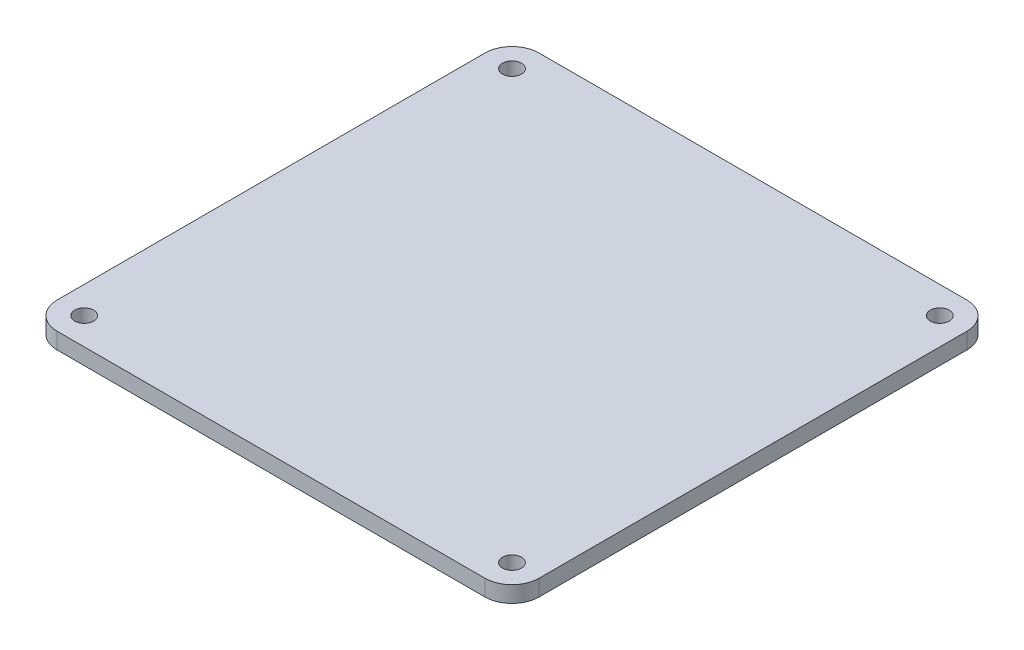
from build123d import *

# Parameters (mm, degrees)
SKETCH1_R           = 1.75
BOSS_EXTRUDE1_DEPTH = 3


with BuildPart() as part:
    # Sketch1 → Boss-Extrude1 (new body)
    with BuildSketch(Plane(origin=(0, 0, 0), x_dir=(1, 0, 0), z_dir=(0, 1, 0))):
        with BuildLine():
            ThreePointArc((-44.494041124, 39.494041124), (-43.02957503, 43.02957503), (-39.494041124, 44.494041124))
            Line((-39.494041124, 44.494041124), (0, 44.494041124))
            Line((0, 44.494041124), (39.494041124, 44.494041124))
            ThreePointArc((39.494041124, 44.494041124), (43.02957503, 43.02957503), (44.494041124, 39.494041124))
            Line((44.494041124, 39.494041124), (44.494041124, 0))
            Line((44.494041124, 0), (44.494041124, -39.494041124))
            ThreePointArc((44.494041124, -39.494041124), (43.02957503, -43.02957503), (39.494041124, -44.494041124))
            Line((39.494041124, -44.494041124), (0, -44.494041124))
            Line((0, -44.494041124), (-39.494041124, -44.494041124))
            ThreePointArc((-39.494041124, -44.494041124), (-43.02957503, -43.02957503), (-44.494041124, -39.494041124))
            Line((-44.494041124, -39.494041124), (-44.494041124, 0))
            Line((-44.494041124, 0), (-44.494041124, 39.494041124))
        make_face()
        with Locations(Location((-39.494041124, -39.494041124, 0), (0, 0, 270))):
            Circle(SKETCH1_R, mode=Mode.SUBTRACT)
        with Locations(Location((-39.494041124, 39.494041124, 0), (0, 0, 270))):
            Circle(SKETCH1_R, mode=Mode.SUBTRACT)
        with Locations(Location((39.494041124, 39.494041124, 0), (0, 0, 270))):
            Circle(SKETCH1_R, mode=Mode.SUBTRACT)
        with Locations(Location((39.494041124, -39.494041124, 0), (0, 0, 270))):
            Circle(SKETCH1_R, mode=Mode.SUBTRACT)
    extrude(amount=BOSS_EXTRUDE1_DEPTH)


solid = part.part
